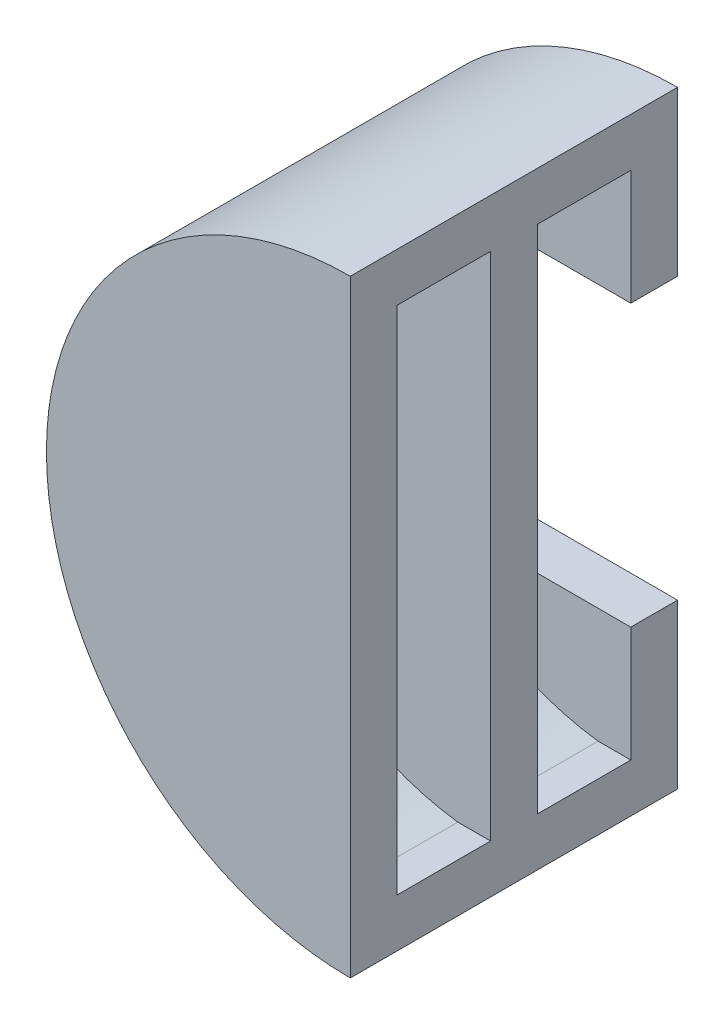
from build123d import *

# Parameters (mm, degrees)
BOSS_EXTRUDE3_DEPTH = 35
CUT_EXTRUDE2_START  = -5
CUT_EXTRUDE2_DEPTH  = 10
CUT_EXTRUDE3_START  = -20
CUT_EXTRUDE3_DEPTH  = 10
SKETCH5_R           = 32.5
BOSS_EXTRUDE6_DEPTH = 2
CUT_EXTRUDE4_START  = -2
CUT_EXTRUDE4_DEPTH  = 2
SKETCH8_R           = 2.5
CUT_EXTRUDE5_DEPTH  = 60.004237136
BOSS_EXTRUDE8_DEPTH = 35
SKETCH10_W          = 10
SKETCH10_H          = 54.621977686
CUT_EXTRUDE6_DEPTH  = 11.5
SKETCH8_4_R         = 2.5
CUT_EXTRUDE7_DEPTH  = 10
SKETCH13_R          = 35.016935796
CUT_EXTRUDE10_DEPTH = 2
SKETCH14_R          = 6
CUT_EXTRUDE11_DEPTH = 8
CUT_EXTRUDE12_DEPTH = 8


with BuildPart() as part:
    # Sketch1 → Boss-Extrude3 (new body)
    with BuildSketch(Plane.XY):
        with BuildLine():
            Line((-3.5, 32.310988843), (-3.5, -32.310988843))
            ThreePointArc((-3.5, -32.310988843), (-32.5, 0), (-3.5, 32.310988843))
        make_face()
    extrude(amount=BOSS_EXTRUDE3_DEPTH)

    # Sketch4 → Cut-Extrude2 (cut)
    with BuildSketch(Plane(origin=(0, 0, 0), x_dir=(-1, 0, 0), z_dir=(0, 0, -1)).offset(CUT_EXTRUDE2_START)):
        with BuildLine():
            Line((3.5, 0), (3.5, 27.310988843))
            ThreePointArc((3.5, 27.310988843), (27.534344219, 0), (3.5, -27.310988843))
            Line((3.5, -27.310988843), (3.5, 0))
        make_face()
    extrude(amount=-CUT_EXTRUDE2_DEPTH, mode=Mode.SUBTRACT)

    # Sketch4<9> → Cut-Extrude3 (cut)
    with BuildSketch(Plane(origin=(0, 0, 0), x_dir=(-1, 0, 0), z_dir=(0, 0, -1)).offset(CUT_EXTRUDE3_START)):
        with BuildLine():
            Line((3.5, 0), (3.5, 27.310988843))
            ThreePointArc((3.5, 27.310988843), (27.534344219, 0), (3.5, -27.310988843))
            Line((3.5, -27.310988843), (3.5, 0))
        make_face()
    extrude(amount=-CUT_EXTRUDE3_DEPTH, mode=Mode.SUBTRACT)

    # Sketch5 → Boss-Extrude6 (add, symmetric)
    with BuildSketch(Plane(origin=(0, 0, 0), x_dir=(-1, 0, 0), z_dir=(0, 0, -1))):
        Circle(SKETCH5_R)
    extrude(amount=BOSS_EXTRUDE6_DEPTH, both=True)

    # Sketch6 → Cut-Extrude4 (cut)
    with BuildSketch(Plane.XY.offset(2).offset(CUT_EXTRUDE4_START)):
        with BuildLine():
            Line((-3.5, 32.310988843), (-3.5, -32.310988843))
            ThreePointArc((-3.5, -32.310988843), (32.5, 0), (-3.5, 32.310988843))
        make_face()
    extrude(amount=CUT_EXTRUDE4_DEPTH, mode=Mode.SUBTRACT)

    # Sketch8 → Cut-Extrude5 (cut, through all)
    with BuildSketch(Plane(origin=(0, 0, -2), x_dir=(-1, 0, 0), z_dir=(0, 0, -1))):
        Circle(SKETCH8_R)
    extrude(amount=-CUT_EXTRUDE5_DEPTH, mode=Mode.SUBTRACT)

    # Sketch12 → Boss-Extrude8 (add)
    with BuildSketch(Plane.XY):
        with BuildLine():
            Line((0, 32.5), (0, -32.5))
            ThreePointArc((0, -32.5), (-1.752549943, -32.452712809), (-3.5, -32.310988843))
            Line((-3.5, -32.310988843), (-3.5, 32.310988843))
            ThreePointArc((-3.5, 32.310988843), (-1.752549943, 32.452712809), (0, 32.5))
        make_face()
    extrude(amount=BOSS_EXTRUDE8_DEPTH)

    # Sketch10 → Cut-Extrude6 (cut)
    with BuildSketch(Plane(origin=(-3.5, 0, 0), x_dir=(0, 0, -1), z_dir=(1, 0, 0))):
        with Locations((-10, 0)):
            Rectangle(SKETCH10_W, SKETCH10_H)
        with Locations((-25, 0)):
            Rectangle(SKETCH10_W, SKETCH10_H)
    extrude(amount=CUT_EXTRUDE6_DEPTH, mode=Mode.SUBTRACT)

    # Sketch8<4> → Cut-Extrude7 (cut)
    with BuildSketch(Plane(origin=(0, 0, -2), x_dir=(-1, 0, 0), z_dir=(0, 0, -1))):
        Circle(SKETCH8_4_R)
    extrude(amount=-CUT_EXTRUDE7_DEPTH, mode=Mode.SUBTRACT)

    # Sketch13 → Cut-Extrude10 (cut)
    with BuildSketch(Plane(origin=(0, 0, -2), x_dir=(-1, 0, 0), z_dir=(0, 0, -1))):
        Circle(SKETCH13_R)
    extrude(amount=-CUT_EXTRUDE10_DEPTH, mode=Mode.SUBTRACT)

    # Sketch14 → Cut-Extrude11 (cut)
    with BuildSketch(Plane(origin=(0, 0, 0), x_dir=(-1, 0, 0), z_dir=(0, 0, -1))):
        Circle(SKETCH14_R)
    extrude(amount=-CUT_EXTRUDE11_DEPTH, mode=Mode.SUBTRACT)

    # Sketch15 → Cut-Extrude12 (cut)
    with BuildSketch(Plane(origin=(0, 0, 0), x_dir=(-1, 0, 0), z_dir=(0, 0, -1))):
        Polygon((0, 0), (0, 15), (22.08, 15), (22.08, -15), (0, -15), align=None)
    extrude(amount=-CUT_EXTRUDE12_DEPTH, mode=Mode.SUBTRACT)


solid = part.part
